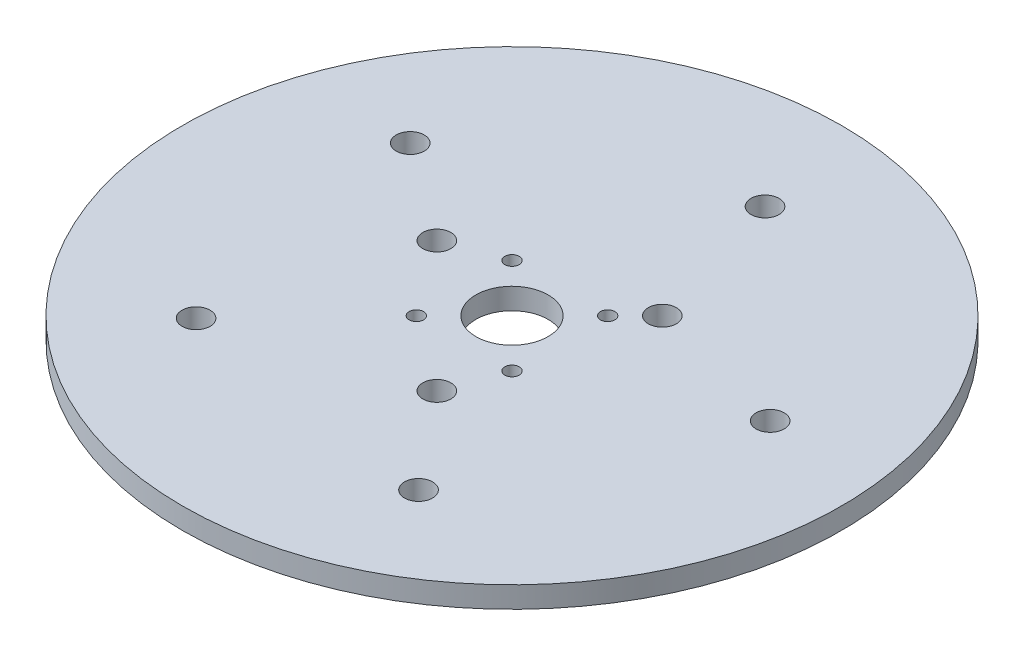
from build123d import *

# Parameters (mm, degrees)
SKETCH1_R            = 77.5
SKETCH1_R_2          = 8.5
BODY_DEPTH           = 5
M6_CLEARANCE_HOLE1_D = 6.6
M3_CLEARANCE_HOLE1_D = 3.4
M6_CLEARANCE_HOLE2_D = 6.6


with BuildPart() as part:
    # Sketch1 → Body (new body)
    with BuildSketch(Plane(origin=(0, 0, 0), x_dir=(1, 0, 0), z_dir=(0, 1, 0))):
        with Locations(Location((0, 0, 0), (0, 0, 270))):
            Circle(SKETCH1_R)
        with Locations(Location((0, 0, 0), (0, 0, 270))):
            Circle(SKETCH1_R_2, mode=Mode.SUBTRACT)
    extrude(amount=BODY_DEPTH)

    # M6 Clearance Hole1 (through all)
    with Locations(Plane(origin=(0, 5, 0), x_dir=(1, 0, 0), z_dir=(0, 1, 0))):
        with Locations((7.5, 52), (51.772566305, 8.935959835), (24.497205661, -46.4772731), (-36.632460577, -37.660494315), (-47.13731139, 23.20180758), (0, 0)):
            Hole(M6_CLEARANCE_HOLE1_D / 2)

    # M3 Clearance Hole1 (through all)
    with Locations(Plane(origin=(0, 5, 0), x_dir=(1, 0, 0), z_dir=(0, 1, 0))):
        with Locations((0, 0), (-11.25, 11.25), (11.25, -11.25), (11.25, 11.25), (-11.25, -11.25)):
            Hole(M3_CLEARANCE_HOLE1_D / 2)

    # M6 Clearance Hole2 (through all)
    with Locations(Plane(origin=(0, 5, 0), x_dir=(1, 0, 0), z_dir=(0, 1, 0))):
        with Locations((17.67766953, 17.67766953), (6.470476128, -24.148145657), (-24.148145657, 6.470476128), (0, 0)):
            Hole(M6_CLEARANCE_HOLE2_D / 2)


solid = part.part
